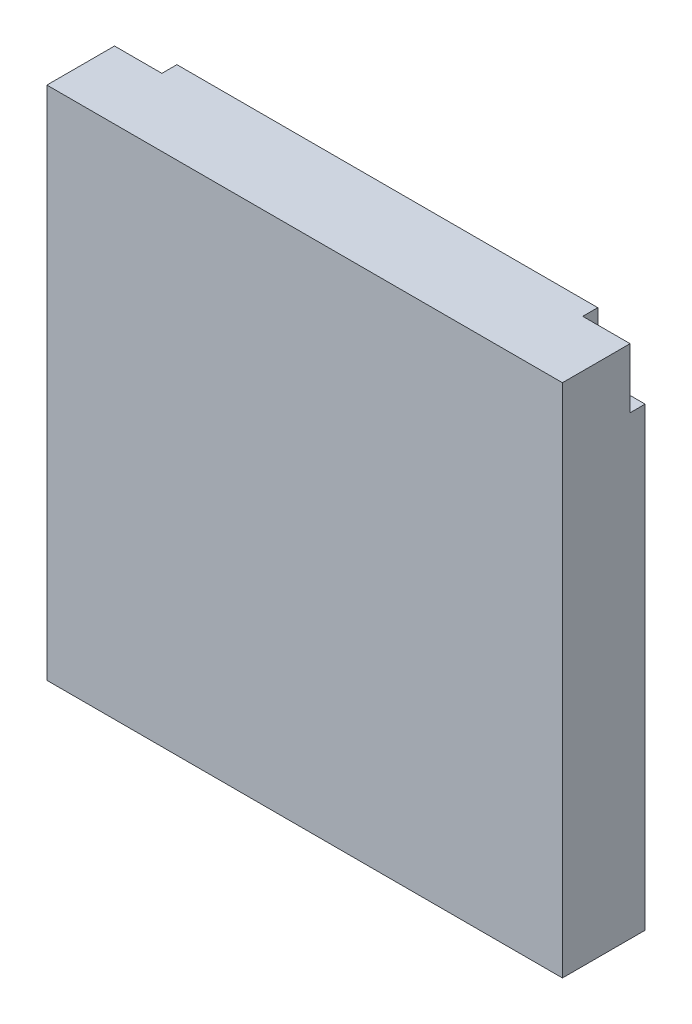
from build123d import *

# Parameters (mm, degrees)
SKETCH1_W           = 3.43
SKETCH1_H           = 3.43
BOSS_EXTRUDE1_DEPTH = 0.55
SKETCH3_R           = 0.127973113
SKETCH3_W           = 0.315
SKETCH3_H           = 0.398213576
CUT_EXTRUDE1_DEPTH  = 0.1


with BuildPart() as part:
    # Sketch1 → Boss-Extrude1 (new body)
    with BuildSketch(Plane.XY):
        with Locations((1.715, 1.715)):
            Rectangle(SKETCH1_W, SKETCH1_H)
    extrude(amount=BOSS_EXTRUDE1_DEPTH)

    # Sketch3 → Cut-Extrude1 (cut)
    with BuildSketch(Plane(origin=(0, 0, 0), x_dir=(-1, 0, 0), z_dir=(0, 0, -1))):
        with Locations((-3.115, 0.328910616)):
            Circle(SKETCH3_R)
        with Locations((-3.2725, 3.230893212)):
            Rectangle(SKETCH3_W, SKETCH3_H)
        with Locations((-0.1575, 3.230893212)):
            Rectangle(SKETCH3_W, SKETCH3_H)
    extrude(amount=-CUT_EXTRUDE1_DEPTH, mode=Mode.SUBTRACT)


solid = part.part
